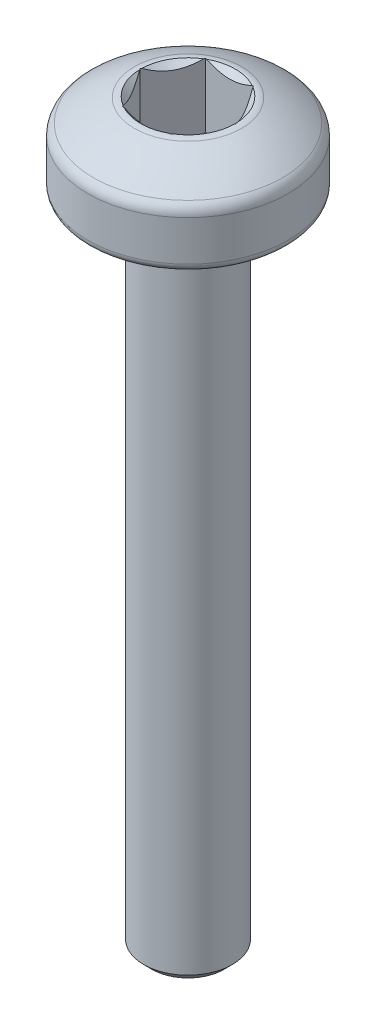
from build123d import *

# Parameters (mm, degrees)
CUT_EXTRUDE2_DEPTH = 13.123312269


with BuildPart() as part:
    # Sketch1 → Revolve1 (revolve)
    with BuildSketch(Plane(origin=(0, 0, 0), x_dir=(0, 0, -1), z_dir=(1, 0, 0))):
        with BuildLine():
            ThreePointArc((0.8, 11.7), (0.843933983, 11.806066017), (0.95, 11.85))
            Line((0.95, 11.85), (1.66, 11.85))
            ThreePointArc((1.66, 11.85), (1.766066017, 11.893933983), (1.81, 12))
            Line((1.81, 12), (1.81, 12.728765944))
            ThreePointArc((1.81, 12.728765944), (1.783686321, 12.840410154), (1.710284562, 12.928552205))
            ThreePointArc((1.710284562, 12.928552205), (1.354338624, 13.156968158), (0.968464524, 13.330093943))
            ThreePointArc((0.968464524, 13.330093943), (0.922426778, 13.343109085), (0.875, 13.349399447))
            Line((0.875, 13.349399447), (0.875, 12.256185485))
            ThreePointArc((0.875, 12.256185485), (0.845317103, 12.166609847), (0.768016069, 12.112485736))
            ThreePointArc((0.768016069, 12.112485736), (0.646674627, 12.079247272), (0.523906049, 12.051744226))
            ThreePointArc((0.523906049, 12.051744226), (0.263227569, 12.012967451), (0, 12))
            Line((0, 12), (0, 0))
            Line((0, 0), (0.65, 0))
            Line((0.65, 0), (0.8, 0.15))
            Line((0.8, 0.15), (0.8, 11.7))
        make_face()
    revolve(axis=Axis((0, 13.5, 0), (0, -1, 0)))


with BuildPart() as body_2:
    # Sketch1<3> → Revolve2 (revolve)
    with BuildSketch(Plane(origin=(0, 0, 0), x_dir=(0, 0, -1), z_dir=(1, 0, 0))):
        with BuildLine():
            Line((0.875, 12.256185485), (0.875, 13.349399447))
            ThreePointArc((0.875, 13.349399447), (0.865004507, 13.349849828), (0.855, 13.35))
            Line((0.855, 13.35), (0.725, 13.22))
            Line((0.725, 13.22), (0.725, 12.29691396))
            ThreePointArc((0.725, 12.29691396), (0.668295774, 12.138368245), (0.523906049, 12.051744226))
            ThreePointArc((0.523906049, 12.051744226), (0.646674627, 12.079247272), (0.768016069, 12.112485736))
            ThreePointArc((0.768016069, 12.112485736), (0.845317103, 12.166609847), (0.875, 12.256185485))
        make_face()
    revolve(axis=Axis((0, 13.5, 0), (0, -1, 0)))

    # Sketch2 → Cut-Extrude2 (cut, through all)
    with BuildSketch(Plane.XZ.offset(-11.85)):
        Polygon((-0.433012702, 0.75), (-0.866025404, 0), (-0.433012702, -0.75), (0.433012702, -0.75), (0.866025404, 0), (0.433012702, 0.75), align=None)
    extrude(amount=-CUT_EXTRUDE2_DEPTH, mode=Mode.SUBTRACT)


with BuildPart() as part_1:
    add(part.part)

    # Combine1: union body 2
    add(body_2.part)


solid = part_1.part
